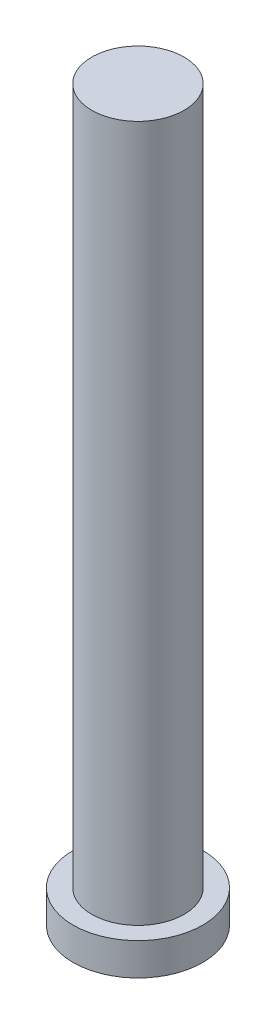
from build123d import *

# Parameters (mm, degrees)
SKETCH1_R           = 4
BOSS_EXTRUDE1_DEPTH = 2
SKETCH2_R           = 2.85
BOSS_EXTRUDE2_DEPTH = 43


with BuildPart() as part:
    # Sketch1 → Boss-Extrude1 (new body)
    with BuildSketch(Plane(origin=(0, 0, 0), x_dir=(1, 0, 0), z_dir=(0, 1, 0))):
        with Locations(Location((0, 0, 0), (0, 0, 270))):
            Circle(SKETCH1_R)
    extrude(amount=BOSS_EXTRUDE1_DEPTH)

    # Sketch2 → Boss-Extrude2 (add)
    with BuildSketch(Plane(origin=(0, 2, 0), x_dir=(1, 0, 0), z_dir=(0, 1, 0))):
        with Locations(Location((0, 0, 0), (0, 0, 270))):
            Circle(SKETCH2_R)
    extrude(amount=BOSS_EXTRUDE2_DEPTH)


solid = part.part
